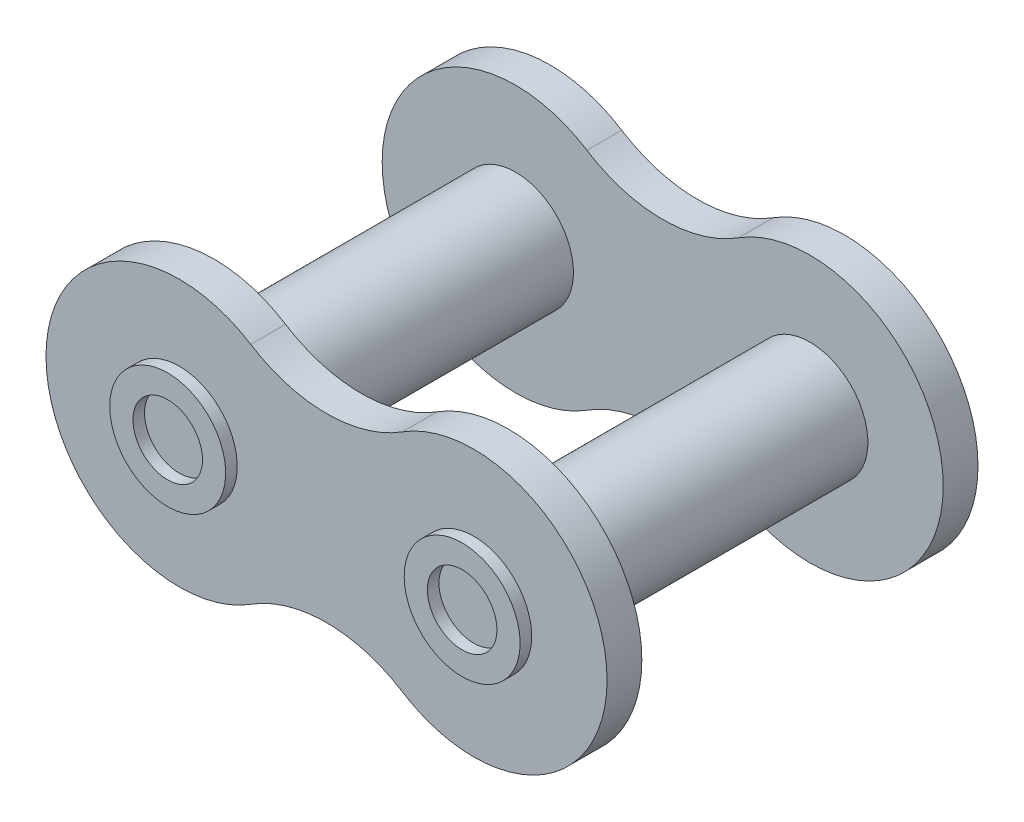
from build123d import *

# Parameters (mm, degrees)
SKETCH1_R                = 2.5
BOSS_EXTRUDE3_DEPTH      = 6.5
BOSS_EXTRUDE3_2_DEPTH    = 6.5
BOSS_EXTRUDE7_START      = -6.5
BOSS_EXTRUDE7_DEPTH      = 1.5
BOSS_EXTRUDE8_DEPTH      = 8.5
BOSS_EXTRUDE8_DEPTH_BACK = 8.5
SKETCH2_R                = 2.5
SKETCH3_R                = 1.5
CUT_EXTRUDE1_DEPTH       = 0.5
CUT_EXTRUDE2_START       = -0.5
SKETCH4_R                = 1.5
CUT_EXTRUDE2_DEPTH       = 0.5


with BuildPart() as part:
    # Sketch1 → Boss-Extrude3 (new, symmetric)
    with BuildSketch(Plane.XY):
        with Locations(Location((6.35, 0, 0), (0, 0, 180))):
            Circle(SKETCH1_R)
    extrude(amount=BOSS_EXTRUDE3_DEPTH, both=True)



with BuildPart() as body_2:
    # Sketch1 → Boss-Extrude3 2 (new, symmetric)
    with BuildSketch(Plane.XY):
        with Locations(Location((-6.35, 0, 0), (0, 0, 180))):
            Circle(SKETCH1_R)
    extrude(amount=BOSS_EXTRUDE3_2_DEPTH, both=True)


with BuildPart() as part_1:
    add(part.part)

    add(body_2.part)  # Boss-Extrude7 merges body 2
    # Sketch1<5> → Boss-Extrude7 (add)
    with BuildSketch(Plane.XY.offset(BOSS_EXTRUDE7_START)):
        with BuildLine():
            ThreePointArc((-3.267678659, 4.854049356), (-12.1, 0), (-3.267678659, -4.854049356))
            ThreePointArc((-3.267678659, -4.854049356), (0, -3.904220161), (3.267678659, -4.854049356))
            ThreePointArc((3.267678659, -4.854049356), (12.1, 0), (3.267678659, 4.854049356))
            ThreePointArc((3.267678659, 4.854049356), (0, 3.904220161), (-3.267678659, 4.854049356))
        make_face()
    boss_extrude7 = extrude(amount=-BOSS_EXTRUDE7_DEPTH)

    # Mirror1: Boss-Extrude7 across plane
    add(boss_extrude7.mirror(Plane.XY))

    # Sketch2 → Boss-Extrude8 (add, two sides: drawn at the far end of the back side and taken through both)
    with BuildSketch(Plane.XY.offset(-BOSS_EXTRUDE8_DEPTH_BACK)):
        with Locations(Location((-6.35, 0, 0), (0, 0, 180))):
            Circle(SKETCH2_R)
        with Locations(Location((6.35, 0, 0), (0, 0, 180))):
            Circle(SKETCH2_R)
    extrude(amount=BOSS_EXTRUDE8_DEPTH + BOSS_EXTRUDE8_DEPTH_BACK)

    # Sketch3 → Cut-Extrude1 (cut)
    with BuildSketch(Plane.XY.offset(8.5)):
        with Locations((-6.35, 0)):
            Circle(SKETCH3_R)
        with Locations((6.35, 0)):
            Circle(SKETCH3_R)
    extrude(amount=-CUT_EXTRUDE1_DEPTH, mode=Mode.SUBTRACT)

    # Sketch4 → Cut-Extrude2 (cut)
    with BuildSketch(Plane(origin=(0, 0, -8.5), x_dir=(-1, 0, 0), z_dir=(0, 0, -1)).offset(CUT_EXTRUDE2_START)):
        with Locations(Location((6.35, 0, 0), (0, 0, 180))):
            Circle(SKETCH4_R)
        with Locations(Location((-6.35, 0, 0), (0, 0, 180))):
            Circle(SKETCH4_R)
    extrude(amount=CUT_EXTRUDE2_DEPTH, mode=Mode.SUBTRACT)


solid = part_1.part
